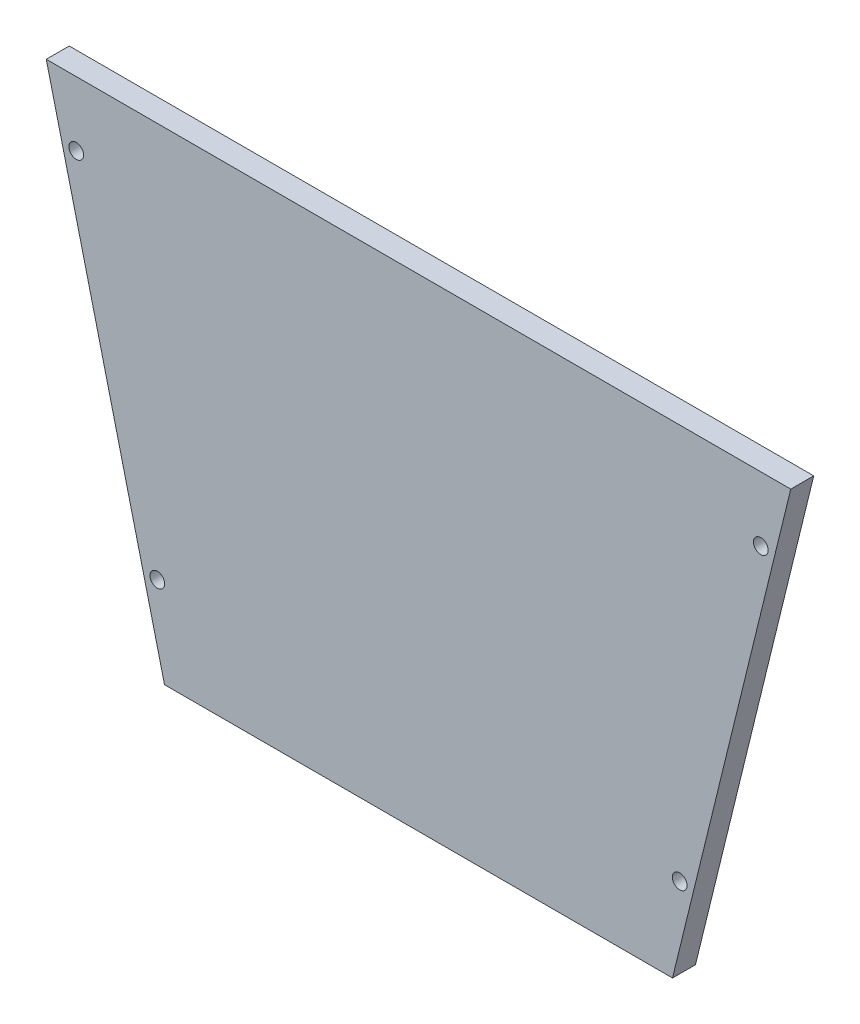
from build123d import *

# Parameters (mm, degrees)
EXTRUDE_2_DEPTH     = 5
SKETCH_3_R          = 1.6
CUT_EXTRUDE_1_DEPTH = 172.275363085
SKETCH_4_W          = 164.707045146
SKETCH_4_H          = 1
CUT_EXTRUDE_2_DEPTH = 172.275363085
EXTRUDE_3_DEPTH     = 5


with BuildPart() as part:
    # 草图2 → 凸台-拉伸2 (new body)
    with BuildSketch(Plane.XY):
        Polygon((0, 0), (112.5, 0), (137.5, 102), (-25, 102), align=None)
    extrude(amount=EXTRUDE_2_DEPTH)

    # 草图3 → 切除-拉伸1 (cut, through all)
    with BuildSketch(Plane.XY.offset(5)):
        with Locations((-18.234733944, 87)):
            Circle(SKETCH_3_R)
        with Locations((113.087675121, 15)):
            Circle(SKETCH_3_R)
        with Locations((-0.587675121, 15)):
            Circle(SKETCH_3_R)
        with Locations((130.734733944, 87)):
            Circle(SKETCH_3_R)
    extrude(amount=-CUT_EXTRUDE_1_DEPTH, mode=Mode.SUBTRACT)

    # 草图4 → 切除-拉伸2 (cut, through all)
    with BuildSketch(Plane.XY.offset(5)):
        with Locations((57.353522573, 101.5)):
            Rectangle(SKETCH_4_W, SKETCH_4_H)
    extrude(amount=-CUT_EXTRUDE_2_DEPTH, mode=Mode.SUBTRACT)

    # 草图5 → 凸台-拉伸3 (add)
    with BuildSketch(Plane.XY.offset(5)):
        Polygon((0, 0), (0.980392157, -4), (111.519607843, -4), (112.5, 0), align=None)
    extrude(amount=-EXTRUDE_3_DEPTH)


solid = part.part
